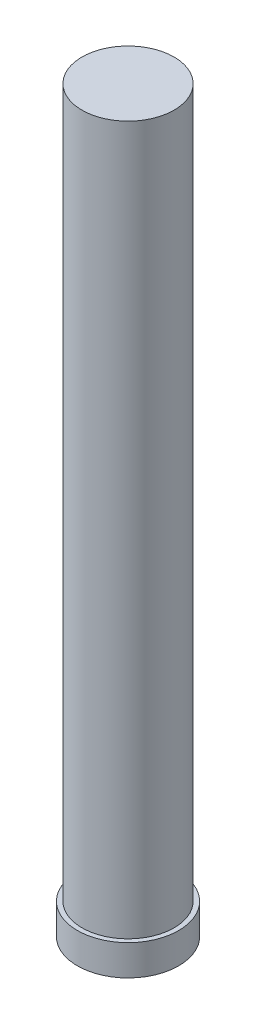
from build123d import *

# Parameters (mm, degrees)
CROQUIS2_W = 50
CROQUIS2_H = 800


with BuildPart() as part:
    # Croquis2 → Revolución1 (revolve)
    with BuildSketch(Plane(origin=(0, 0, 0), x_dir=(0, 0, -1), z_dir=(1, 0, 0)), mode=Mode.PRIVATE) as revoluci_n1_sk:
        with Locations((-402.616926503, 400)):
            Rectangle(CROQUIS2_W, CROQUIS2_H)
    revolve(revoluci_n1_sk.sketch.rotate(Axis((0, -122.494432071, 377.616926503), (0, 1, 0)), 180), axis=Axis((0, -122.494432071, 377.616926503), (0, 1, 0)))

    # Croquis3 → Revolución2 (revolve)
    with BuildSketch(Plane(origin=(0, 0, 0), x_dir=(0, 0, -1), z_dir=(1, 0, 0))):
        Polygon((-327.616926503, 31.235124472), (-322.616926503, 31.235124472), (-322.616926503, -1.999240636), (-377.616926503, -1.999240636), (-377.616926503, 0), (-327.616926503, 0), align=None)
    revolve(axis=Axis((0, -5.624697561, 377.616926503), (0, 1, 0)))


solid = part.part
